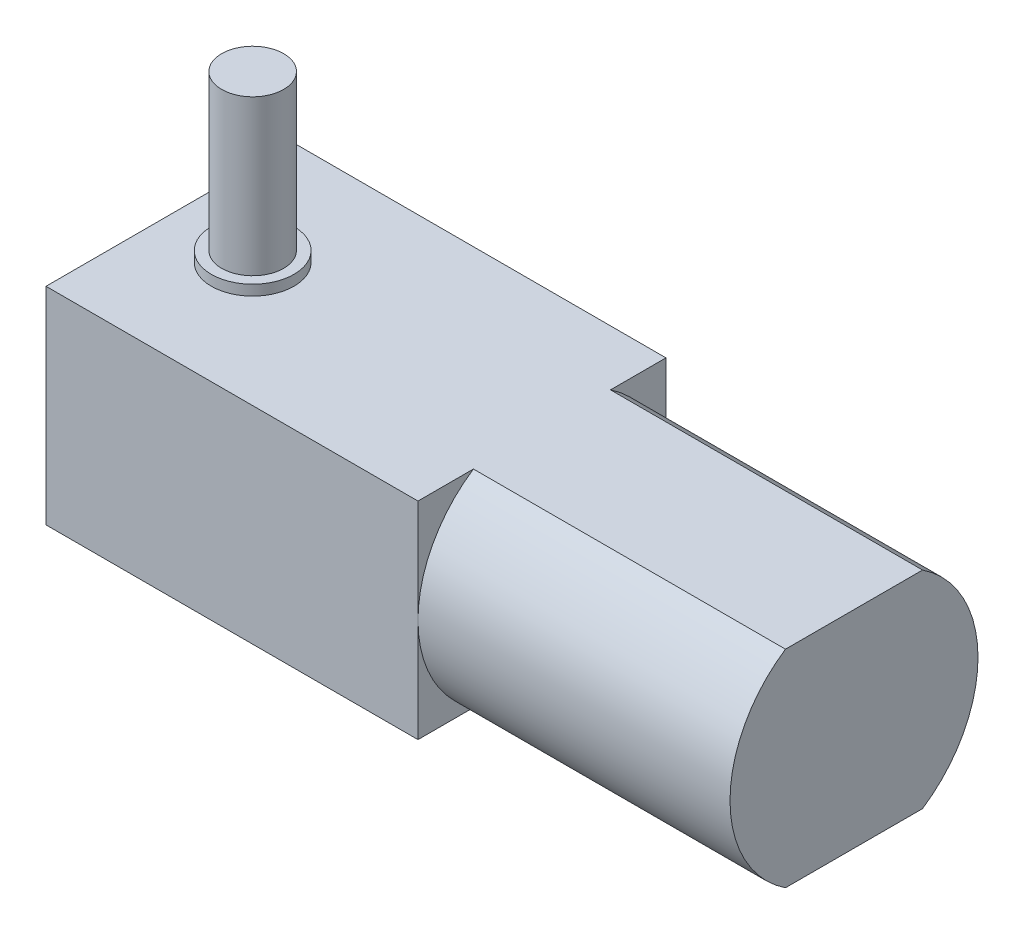
from build123d import *

# Parameters (mm, degrees)
BOSS_EXTRUDE1_DEPTH = 15.1
BOSS_EXTRUDE2_START = -18
BOSS_EXTRUDE2_DEPTH = 18
BOSS_EXTRUDE3_START = 5
SKETCH2_R           = 1.5
BOSS_EXTRUDE3_DEPTH = 8
BOSS_EXTRUDE4_START = 5
SKETCH2_3_R         = 2
SKETCH2_3_R_2       = 1.5
BOSS_EXTRUDE4_DEPTH = 0.5


with BuildPart() as part:
    # Sketch1 → Boss-Extrude1 (new body)
    with BuildSketch(Plane(origin=(0, 0, 0), x_dir=(0, 0, -1), z_dir=(1, 0, 0))):
        with BuildLine():
            Line((3.31662479, 5), (-3.31662479, 5))
            ThreePointArc((-3.31662479, 5), (-5.286764074, 2.837274331), (-6, 0))
            ThreePointArc((-6, 0), (-5.286764074, -2.837274331), (-3.31662479, -5))
            Line((-3.31662479, -5), (3.31662479, -5))
            ThreePointArc((3.31662479, -5), (5.286764074, -2.837274331), (6, 0))
            ThreePointArc((6, 0), (5.286764074, 2.837274331), (3.31662479, 5))
        make_face()
    extrude(amount=BOSS_EXTRUDE1_DEPTH)

    # Sketch1<3> → Boss-Extrude2 (add)
    with BuildSketch(Plane(origin=(0, 0, 0), x_dir=(0, 0, -1), z_dir=(1, 0, 0)).offset(BOSS_EXTRUDE2_START)):
        with BuildLine():
            Line((-3.31662479, 5), (-6, 5))
            Line((-6, 5), (-6, 0))
            ThreePointArc((-6, 0), (-5.286764074, 2.837274331), (-3.31662479, 5))
        make_face()
        with BuildLine():
            Line((3.31662479, 5), (-3.31662479, 5))
            ThreePointArc((-3.31662479, 5), (-5.286764074, 2.837274331), (-6, 0))
            ThreePointArc((-6, 0), (-5.286764074, -2.837274331), (-3.31662479, -5))
            Line((-3.31662479, -5), (3.31662479, -5))
            ThreePointArc((3.31662479, -5), (5.286764074, -2.837274331), (6, 0))
            ThreePointArc((6, 0), (5.286764074, 2.837274331), (3.31662479, 5))
        make_face()
        with BuildLine():
            Line((6, 5), (3.31662479, 5))
            ThreePointArc((3.31662479, 5), (5.286764074, 2.837274331), (6, 0))
            Line((6, 0), (6, 5))
        make_face()
        with BuildLine():
            ThreePointArc((-3.31662479, -5), (-5.286764074, -2.837274331), (-6, 0))
            Line((-6, 0), (-6, -5))
            Line((-6, -5), (-3.31662479, -5))
        make_face()
        with BuildLine():
            Line((6, -5), (6, 0))
            ThreePointArc((6, 0), (5.286764074, -2.837274331), (3.31662479, -5))
            Line((3.31662479, -5), (6, -5))
        make_face()
    extrude(amount=BOSS_EXTRUDE2_DEPTH)

    # Sketch2 → Boss-Extrude3 (add)
    with BuildSketch(Plane(origin=(0, 0, 0), x_dir=(1, 0, 0), z_dir=(0, 1, 0)).offset(BOSS_EXTRUDE3_START)):
        with Locations(Location((-14, 0, 0), (0, 0, 270))):
            Circle(SKETCH2_R)
    extrude(amount=BOSS_EXTRUDE3_DEPTH)

    # Sketch2<3> → Boss-Extrude4 (add)
    with BuildSketch(Plane(origin=(0, 0, 0), x_dir=(1, 0, 0), z_dir=(0, 1, 0)).offset(BOSS_EXTRUDE4_START)):
        with Locations(Location((-14, 0, 0), (0, 0, 270))):
            Circle(SKETCH2_3_R)
        with Locations(Location((-14, 0, 0), (0, 0, 270))):
            Circle(SKETCH2_3_R_2, mode=Mode.SUBTRACT)
    extrude(amount=BOSS_EXTRUDE4_DEPTH)


solid = part.part
